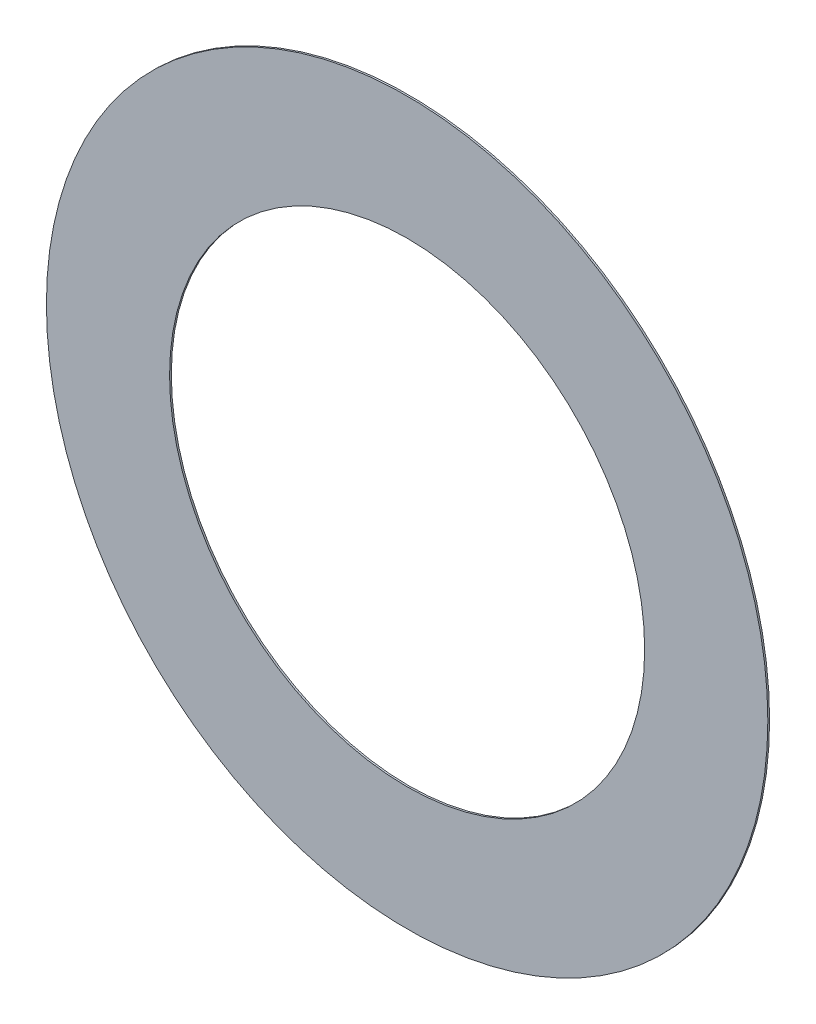
from build123d import *

# Parameters (mm, degrees)
SKETCH1_R           = 20.5
SKETCH1_R_2         = 13.5
BOSS_EXTRUDE1_DEPTH = 0.1


with BuildPart() as part:
    # Sketch1 → Boss-Extrude1 (new body)
    with BuildSketch(Plane.XY):
        Circle(SKETCH1_R)
        Circle(SKETCH1_R_2, mode=Mode.SUBTRACT)
    extrude(amount=BOSS_EXTRUDE1_DEPTH)


solid = part.part
